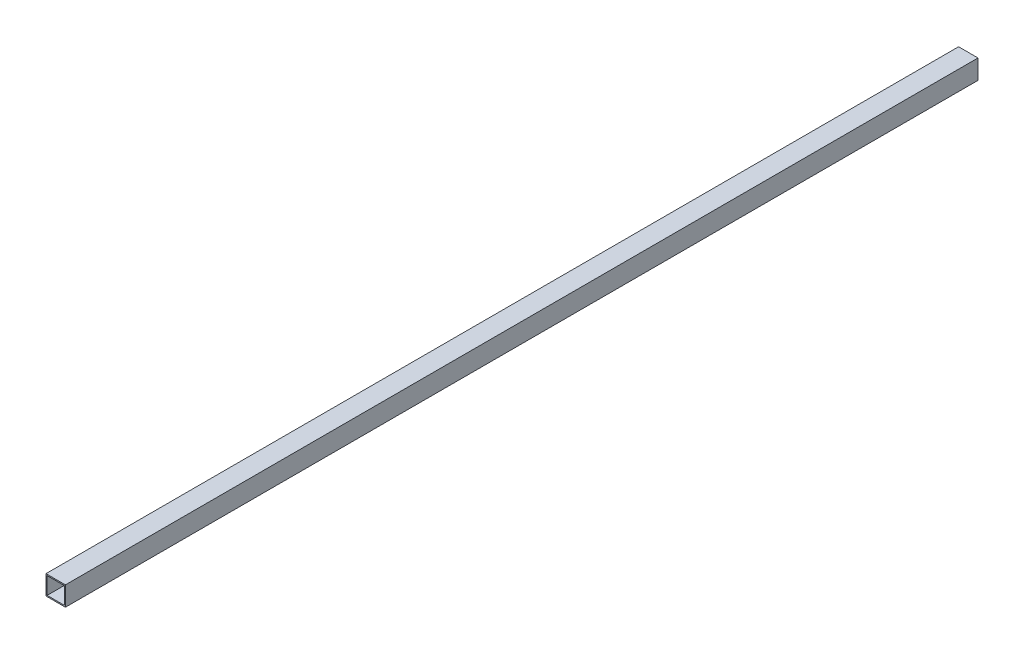
from build123d import *

# Parameters (mm, degrees)
SKETCH1_W           = 25.4
SKETCH1_H           = 25.4
SKETCH1_W_2         = 22.352
SKETCH1_H_2         = 22.352
EXTRUDE_THIN1_DEPTH = 1193.8


with BuildPart() as part:
    # Sketch1 → Extrude-Thin1 (new body)
    with BuildSketch(Plane.XY):
        with Locations((12.7, 12.7)):
            Rectangle(SKETCH1_W, SKETCH1_H)
        with Locations((12.7, 12.7)):
            Rectangle(SKETCH1_W_2, SKETCH1_H_2, mode=Mode.SUBTRACT)
    extrude(amount=EXTRUDE_THIN1_DEPTH)


solid = part.part
